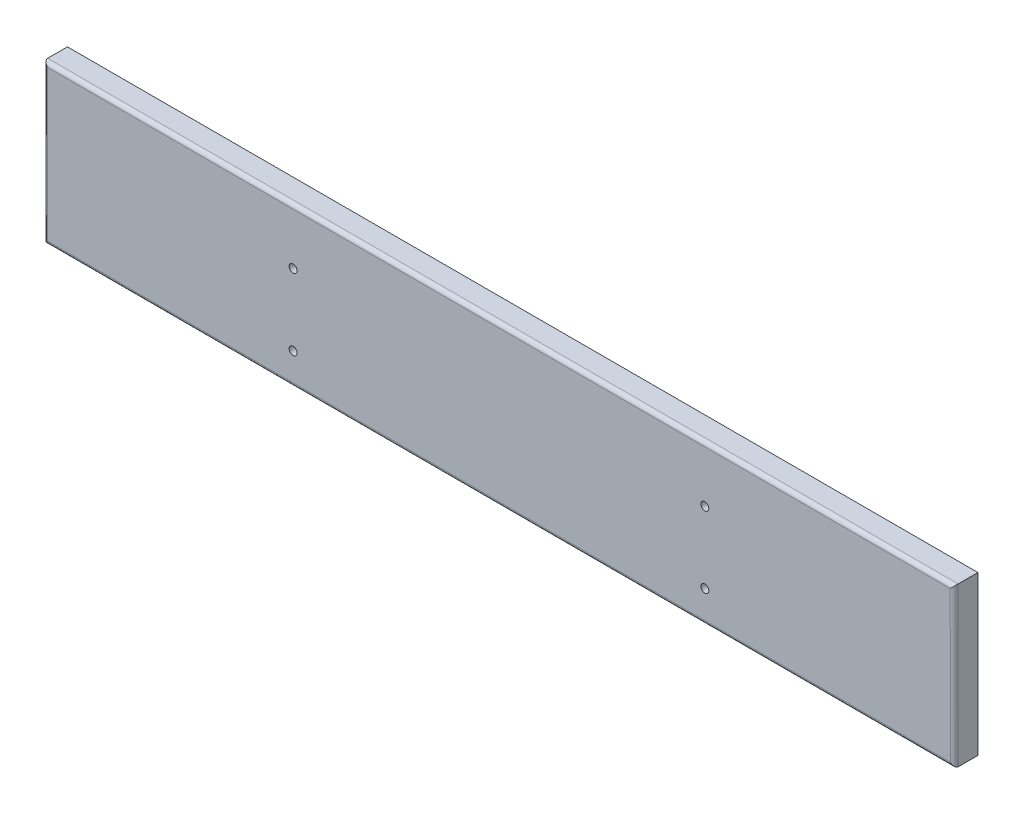
from build123d import *

# Parameters (mm, degrees)
BOSS_EXTRUDE1_DEPTH                  = 19.05
F_1_4_0_25_DIAMETER_HOLE1_AT_2_COUNT = 2
F_1_4_0_25_DIAMETER_HOLE1_AT_2_PITCH = 57.15
F_1_4_0_25_DIAMETER_HOLE1_AT_3_COUNT = 2
F_1_4_0_25_DIAMETER_HOLE1_AT_3_PITCH = 335.10917997
F_1_4_0_25_DIAMETER_HOLE1_AT_4_COUNT = 2
F_1_4_0_25_DIAMETER_HOLE1_AT_4_PITCH = 330.2
FILLET1_R                            = 3.175


with BuildPart() as part:
    # Sketch1 → Boss-Extrude1 (new body)
    with BuildSketch(Plane.XY.offset(-348.182458287)):
        Polygon((378.797753528, 164.483362877), (-351.452246472, 164.483362877), (-351.452246472, 37.483362877), (378.838596905, 37.483362877), align=None)
    extrude(amount=BOSS_EXTRUDE1_DEPTH)

    # Sketch5 → 1/4 (0.25) Diameter Hole1 (revolve, cut)
    with BuildSketch(Plane(origin=(-151.386403095, 120.033362877, -329.132458287), x_dir=(0, -1, 0), z_dir=(1, 0, 0))):
        Polygon((0, 0), (0, 19.05), (3.937, 19.05), (3.175, 18.173419274), (3.175, 0), align=None)
    f_1_4_0_25_diameter_hole1 = revolve(axis=Axis((-151.386403095, 120.033362877, -322.782458287), (0, 0, -1)), mode=Mode.SUBTRACT)

    # 1/4 (0.25) Diameter Hole1 at 2: 1/4 (0.25) Diameter Hole1 ×2
    with Locations(*[(0, -i * F_1_4_0_25_DIAMETER_HOLE1_AT_2_PITCH, 0) for i in range(1, F_1_4_0_25_DIAMETER_HOLE1_AT_2_COUNT)]):
        add(f_1_4_0_25_diameter_hole1, mode=Mode.SUBTRACT)

    # 1/4 (0.25) Diameter Hole1 at 3: 1/4 (0.25) Diameter Hole1 ×2
    with Locations(*[Vector(0.9853505058554479, -0.17054143370575073, 0) * (i * F_1_4_0_25_DIAMETER_HOLE1_AT_3_PITCH) for i in range(1, F_1_4_0_25_DIAMETER_HOLE1_AT_3_COUNT)]):
        add(f_1_4_0_25_diameter_hole1, mode=Mode.SUBTRACT)

    # 1/4 (0.25) Diameter Hole1 at 4: 1/4 (0.25) Diameter Hole1 ×2
    with Locations(*[(i * F_1_4_0_25_DIAMETER_HOLE1_AT_4_PITCH, 0, 0) for i in range(1, F_1_4_0_25_DIAMETER_HOLE1_AT_4_COUNT)]):
        add(f_1_4_0_25_diameter_hole1, mode=Mode.SUBTRACT)

    # Fillet1
    fillet1_edges = [part.edges().sort_by_distance(p)[0] for p in [
        (13.672753528, 164.483362877, -329.132458287),
        (-351.452246472, 100.983362877, -329.132458287),
        (13.693175216, 37.483362877, -329.132458287),
        (378.818175216, 100.983362877, -329.132458287),
    ]]
    fillet(fillet1_edges, radius=FILLET1_R)


solid = part.part
